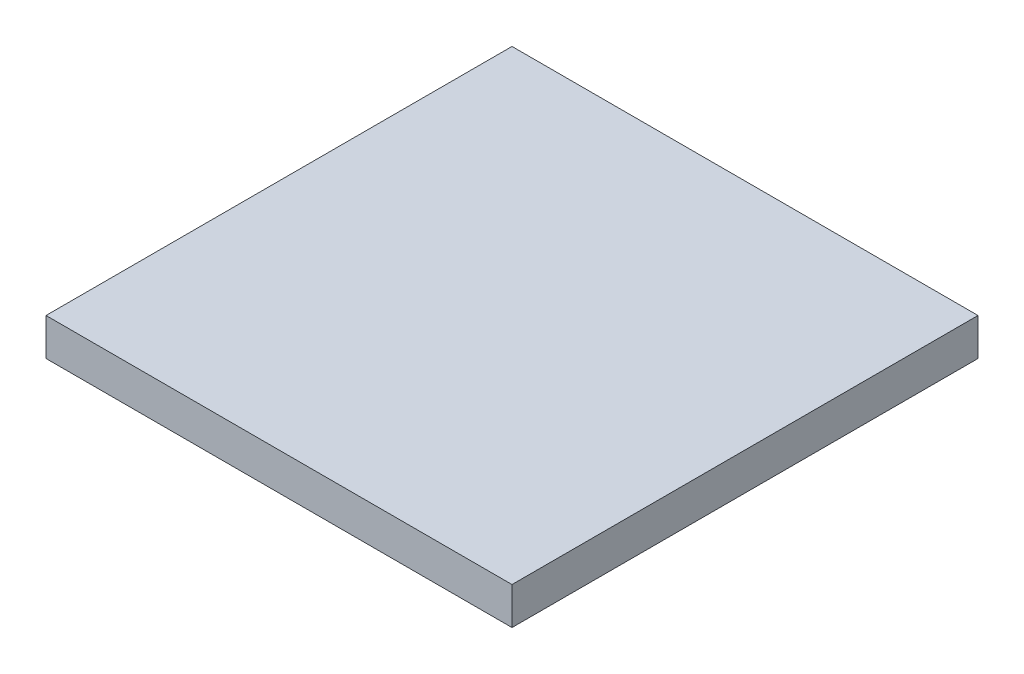
from build123d import *

# Parameters (mm, degrees)
SKETCH1_W           = 25
SKETCH1_H           = 25
BOSS_EXTRUDE1_DEPTH = 2


with BuildPart() as part:
    # Sketch1 → Boss-Extrude1 (new body)
    with BuildSketch(Plane(origin=(0, 0, 0), x_dir=(1, 0, 0), z_dir=(0, 1, 0))):
        with Locations((12.5, 12.5)):
            Rectangle(SKETCH1_W, SKETCH1_H)
    extrude(amount=BOSS_EXTRUDE1_DEPTH)


solid = part.part
